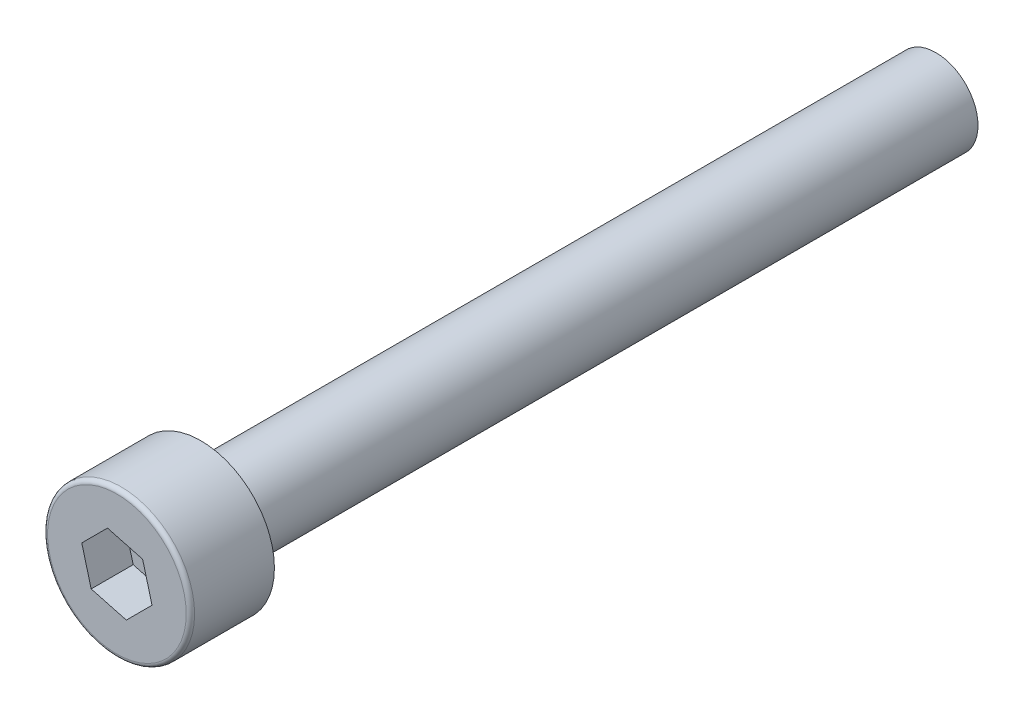
from build123d import *

# Parameters (mm, degrees)
SKETCH_1_R          = 3.5
EXTRUDE_1_DEPTH     = 4
CUT_EXTRUDE_1_DEPTH = 2
SKETCH_3_R          = 2
EXTRUDE_2_DEPTH     = 35
FILLET_1_R          = 0.2


with BuildPart() as part:
    # 草图1 → 凸台-拉伸1 (new body)
    with BuildSketch(Plane.XY):
        Circle(SKETCH_1_R)
    extrude(amount=EXTRUDE_1_DEPTH)

    # 草图2 → 切除-拉伸1 (cut)
    with BuildSketch(Plane.XY.offset(4)):
        Polygon((-1.224744871, -1.224744871), (0.448287736, -1.673032607), (1.673032607, -0.448287736), (1.224744871, 1.224744871), (-0.448287736, 1.673032607), (-1.673032607, 0.448287736), align=None)
    extrude(amount=-CUT_EXTRUDE_1_DEPTH, mode=Mode.SUBTRACT)

    # 草图3 → 凸台-拉伸2 (add)
    with BuildSketch(Plane(origin=(0, 0, 0), x_dir=(-1, 0, 0), z_dir=(0, 0, -1))):
        with Locations(Location((0, 0, 0), (0, 0, 180))):
            Circle(SKETCH_3_R)
    extrude(amount=EXTRUDE_2_DEPTH)

    # 圆角1
    fillet_1_edges = [part.edges().sort_by_distance(p)[0] for p in [
        (-3.5, 0, 4),
    ]]
    fillet(fillet_1_edges, radius=FILLET_1_R)


solid = part.part
